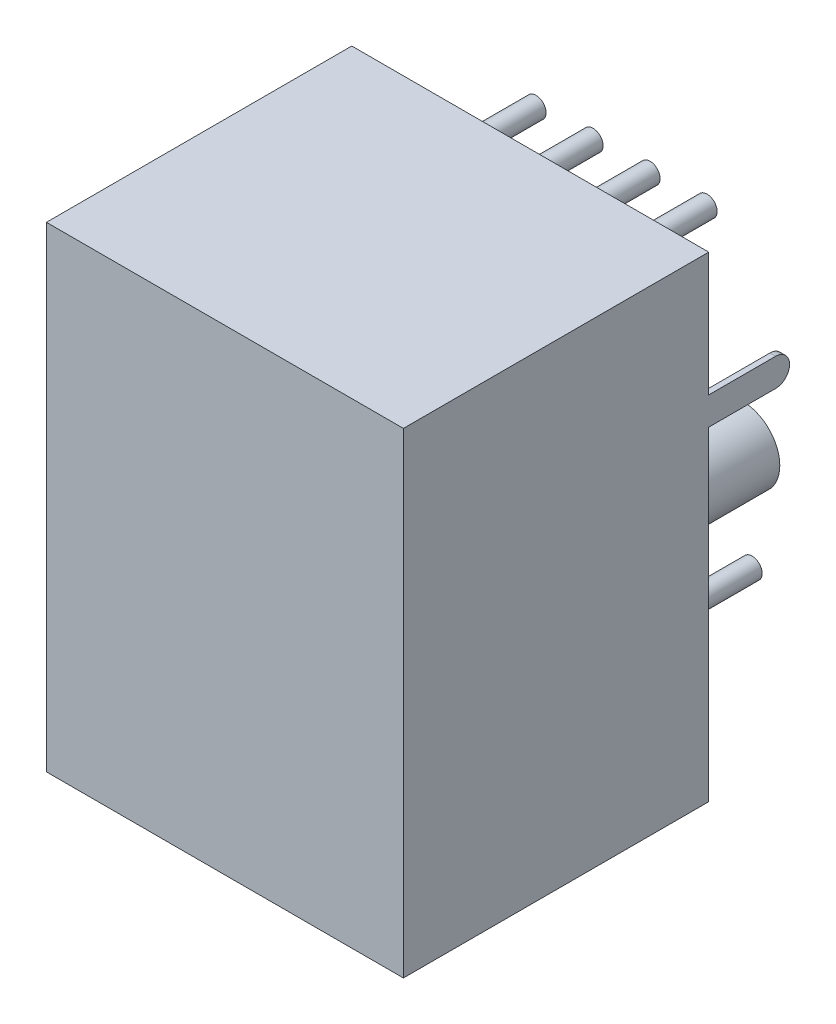
from build123d import *

# Parameters (mm, degrees)
SKETCH1_W           = 15.9
SKETCH1_H           = 13.6
BOSS_EXTRUDE1_DEPTH = 21.2
SKETCH2_R           = 1.65
BOSS_EXTRUDE2_DEPTH = 3.75
CUT_EXTRUDE1_DEPTH  = 11.43
SKETCH4_W           = 11.8364
SKETCH4_H           = 9.906
CUT_EXTRUDE2_DEPTH  = 0.254
SKETCH7_W           = 3.4544
SKETCH7_H           = 2.032
CUT_EXTRUDE3_DEPTH  = 1.27
SKETCH8_W           = 3.4544
SKETCH8_H           = 2.032
BOSS_EXTRUDE3_DEPTH = 1.143
SKETCH9_W           = 3.4544
SKETCH9_H           = 2.032
BOSS_EXTRUDE4_DEPTH = 1.143
BOSS_EXTRUDE5_DEPTH = 0.254
SKETCH11_R          = 0.45
BOSS_EXTRUDE6_DEPTH = 3.25
SKETCH12_R          = 0.45
BOSS_EXTRUDE7_DEPTH = 3.25


with BuildPart() as part:
    # Sketch1 → Boss-Extrude1 (new body)
    with BuildSketch(Plane(origin=(0, 0, 0), x_dir=(1, 0, 0), z_dir=(0, 1, 0))):
        with Locations((7.95, 6.8)):
            Rectangle(SKETCH1_W, SKETCH1_H)
    extrude(amount=BOSS_EXTRUDE1_DEPTH)

    # Sketch2 → Boss-Extrude2 (add)
    with BuildSketch(Plane(origin=(0, 0, -13.6), x_dir=(-1, 0, 0), z_dir=(0, 0, -1))):
        with Locations(Location((-13.665, 10.8, 0), (0, 0, 180))):
            Circle(SKETCH2_R)
        with Locations(Location((-2.235, 10.8, 0), (0, 0, 180))):
            Circle(SKETCH2_R)
    extrude(amount=BOSS_EXTRUDE2_DEPTH)

    # Sketch3 → Cut-Extrude1 (cut)
    with BuildSketch(Plane.XZ):
        Polygon((2.032, -2.54), (13.8684, -2.54), (13.8684, -9.144), (11.1252, -9.144), (11.1252, -10.922), (9.9822, -10.922), (9.9822, -12.446), (5.9182, -12.446), (5.9182, -10.922), (4.7752, -10.922), (4.7752, -9.144), (2.032, -9.144), align=None)
    extrude(amount=-CUT_EXTRUDE1_DEPTH, mode=Mode.SUBTRACT)

    # Sketch4 → Cut-Extrude2 (cut)
    with BuildSketch(Plane.XZ):
        with Locations((7.9502, -7.493)):
            Rectangle(SKETCH4_W, SKETCH4_H)
    extrude(amount=-CUT_EXTRUDE2_DEPTH, mode=Mode.SUBTRACT)

    # Sketch7 → Cut-Extrude3 (cut)
    with BuildSketch(Plane.XZ):
        with Locations((2.794, -11.43)):
            Rectangle(SKETCH7_W, SKETCH7_H)
        with Locations((13.1064, -11.43)):
            Rectangle(SKETCH7_W, SKETCH7_H)
    extrude(amount=-CUT_EXTRUDE3_DEPTH, mode=Mode.SUBTRACT)

    # Sketch10 → Boss-Extrude5 (add)
    with BuildSketch(Plane.ZY):
        with BuildLine():
            Line((-13.6, 14.447874496), (-16.5777, 14.447874496))
            ThreePointArc((-16.5777, 14.447874496), (-17.2, 15.070174496), (-16.5777, 15.692474496))
            Line((-16.5777, 15.692474496), (-13.6, 15.692474496))
            Line((-13.6, 15.692474496), (-13.6, 14.447874496))
        make_face()
    boss_extrude5 = extrude(amount=-BOSS_EXTRUDE5_DEPTH)

    # Mirror2: Boss-Extrude5 across plane
    add(boss_extrude5.mirror(Plane(origin=(7.95, 0, 0), x_dir=(0, 0, 1), z_dir=(1, 0, 0))))

    # Sketch11 → Boss-Extrude6 (add)
    with BuildSketch(Plane(origin=(0, 0, -13.6), x_dir=(-1, 0, 0), z_dir=(0, 0, -1))):
        with Locations(Location((-14.58, 6.74, 0), (0, 0, 180))):
            Circle(SKETCH11_R)
        with Locations(Location((-12.04, 6.74, 0), (0, 0, 180))):
            Circle(SKETCH11_R)
        with Locations(Location((-3.86, 6.74, 0), (0, 0, 180))):
            Circle(SKETCH11_R)
        with Locations(Location((-1.32, 6.74, 0), (0, 0, 180))):
            Circle(SKETCH11_R)
    extrude(amount=BOSS_EXTRUDE6_DEPTH)

    # Sketch12 → Boss-Extrude7 (add)
    with BuildSketch(Plane(origin=(0, 0, -13.6), x_dir=(-1, 0, 0), z_dir=(0, 0, -1))):
        with Locations(Location((-3.685, 17.16, 0), (0, 0, 180))):
            Circle(SKETCH12_R)
        with Locations(Location((-6.225, 17.16, 0), (0, 0, 180))):
            Circle(SKETCH12_R)
        with Locations(Location((-8.765, 17.16, 0), (0, 0, 180))):
            Circle(SKETCH12_R)
        with Locations(Location((-11.305, 17.16, 0), (0, 0, 180))):
            Circle(SKETCH12_R)
        with Locations(Location((-4.955, 19.7, 0), (0, 0, 180))):
            Circle(SKETCH12_R)
        with Locations(Location((-7.495, 19.7, 0), (0, 0, 180))):
            Circle(SKETCH12_R)
        with Locations(Location((-10.035, 19.7, 0), (0, 0, 180))):
            Circle(SKETCH12_R)
        with Locations(Location((-12.575, 19.7, 0), (0, 0, 180))):
            Circle(SKETCH12_R)
    extrude(amount=BOSS_EXTRUDE7_DEPTH)


with BuildPart() as body_2:
    # Sketch8 → Boss-Extrude3 (new body)
    with BuildSketch(Plane.XZ.offset(-1.27)):
        with Locations((2.794, -11.43)):
            Rectangle(SKETCH8_W, SKETCH8_H)
    extrude(amount=BOSS_EXTRUDE3_DEPTH)


with BuildPart() as body_3:
    # Sketch9 → Boss-Extrude4 (new body)
    with BuildSketch(Plane.XZ.offset(-1.27)):
        with Locations((13.1064, -11.43)):
            Rectangle(SKETCH9_W, SKETCH9_H)
    extrude(amount=BOSS_EXTRUDE4_DEPTH)


solid = Compound([part.part, body_2.part, body_3.part])
